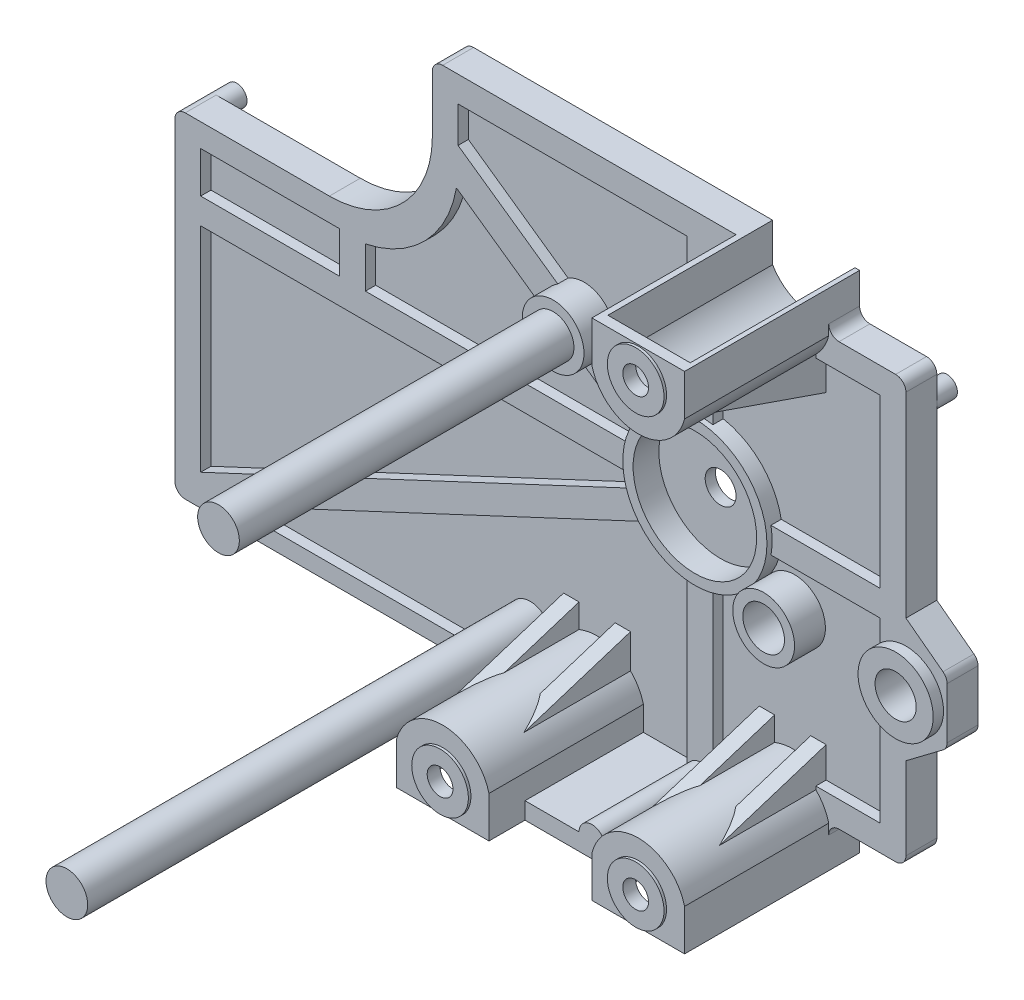
from build123d import *
from build123d.topology import SkipClean

# Parameters (mm, degrees)
SALIENTE_EXTRUIR1_DEPTH     = 3
SALIENTE_EXTRUIR2_DEPTH     = 28
SALIENTE_EXTRUIR3_DEPTH     = 21
CORTAR_EXTRUIR1_START       = -2
CROQUIS7_W                  = 27
CROQUIS7_H                  = 8
CORTAR_EXTRUIR1_DEPTH       = 2
CROQUIS8_R                  = 14
CROQUIS8_R_2                = 12
SALIENTE_EXTRUIR4_DEPTH     = 1
CORTAR_EXTRUIR2_DEPTH       = 39
CORTAR_EXTRUIR2_DEPTH_BACK  = 37
CROQUIS9_R                  = 3
CROQUIS10_R                 = 12
CROQUIS10_R_2               = 3
CORTAR_EXTRUIR3_DEPTH       = 4
SALIENTE_EXTRUIR7_DEPTH     = 1.5
SALIENTE_EXTRUIR8_DEPTH     = 1.5
SALIENTE_EXTRUIR9_DEPTH     = 1.5
SALIENTE_EXTRUIR10_DEPTH    = 1.5
SALIENTE_EXTRUIR11_DEPTH    = 1.5
SALIENTE_EXTRUIR12_DEPTH    = 1.5
CROQUIS22_R                 = 6
CROQUIS22_R_2               = 4.05
SALIENTE_EXTRUIR15_DEPTH    = 6
SALIENTE_EXTRUIR15_2_DEPTH  = 6
CORTAR_EXTRUIR6_DEPTH       = 22
CORTAR_EXTRUIR6_DEPTH_BACK  = 17
CROQUIS23_R                 = 4.05
CROQUIS24_R                 = 5.5
SALIENTE_EXTRUIR16_DEPTH    = 0.5
CROQUIS25_R                 = 2.5
CORTAR_EXTRUIR7_DEPTH       = 40.5
SALIENTE_EXTRUIR17_DEPTH    = 3.282447
CORTAR_EXTRUIR8_DEPTH       = 32
CORTAR_EXTRUIR9_DEPTH       = 32
CORTAR_EXTRUIR10_DEPTH      = 32
SALIENTE_EXTRUIR18_DEPTH    = 4
CROQUIS33_R                 = 0.75
CORTAR_EXTRUIR11_DEPTH      = 4
CROQUIS34_R                 = 2
SALIENTE_EXTRUIR19_DEPTH    = 4
CROQUIS35_R                 = 1
CORTAR_EXTRUIR12_DEPTH      = 3.5
CROQUIS36_R                 = 0.8
SALIENTE_EXTRUIR20_DEPTH    = 0.2
C_PULA1_FACE_RADIUS         = 0.8
C_PULA1_HEIGHT              = 1
CROQUIS39_R                 = 7.3
SALIENTE_EXTRUIR21_DEPTH    = 4
CORTAR_EXTRUIR13_DEPTH      = 26
CORTAR_EXTRUIR13_DEPTH_BACK = 38
CROQUIS40_R                 = 4
CROQUIS41_R                 = 4.05
SALIENTE_EXTRUIR23_DEPTH    = 90
CROQUIS42_R                 = 4.05
SALIENTE_EXTRUIR24_DEPTH    = 65


with BuildPart() as part:
    # Croquis3 → Saliente-Extruir1 (new, symmetric)
    with BuildSketch(Plane.XY):
        with BuildLine():
            Line((48.723300971, -56.222087379), (48.723300971, -50.222087379))
            ThreePointArc((48.723300971, -50.222087379), (49.309087409, -48.807873816), (50.723300971, -48.222087379))
            Line((50.723300971, -48.222087379), (61.723300971, -48.222087379))
            ThreePointArc((61.723300971, -48.222087379), (63.137514533, -47.636300941), (63.723300971, -46.222087379))
            Line((63.723300971, -46.222087379), (63.723300971, -30.222087379))
            Line((63.723300971, -30.222087379), (70.926931017, -24.793762782))
            ThreePointArc((70.926931017, -24.793762782), (71.513169694, -24.088887388), (71.723300971, -23.196491762))
            Line((71.723300971, -23.196491762), (71.723300971, -13.247682996))
            ThreePointArc((71.723300971, -13.247682996), (71.513169694, -12.355287369), (70.926931017, -11.650411975))
            Line((70.926931017, -11.650411975), (63.723300971, -6.222087379))
            Line((63.723300971, -6.222087379), (63.723300971, 31.777912621))
            ThreePointArc((63.723300971, 31.777912621), (63.137514533, 33.192126184), (61.723300971, 33.777912621))
            Line((61.723300971, 33.777912621), (50.723300971, 33.777912621))
            ThreePointArc((50.723300971, 33.777912621), (49.309087409, 34.363699059), (48.723300971, 35.777912621))
            Line((48.723300971, 35.777912621), (48.723300971, 41.777912621))
            Line((48.723300971, 41.777912621), (-26.276699029, 41.777912621))
            ThreePointArc((-26.276699029, 41.777912621), (-27.690912591, 41.192126184), (-28.276699029, 39.777912621))
            Line((-28.276699029, 39.777912621), (-28.276699029, 28.777912621))
            ThreePointArc((-28.276699029, 28.777912621), (-34.134563405, 14.635776998), (-48.276699029, 8.777912621))
            Line((-48.276699029, 8.777912621), (-76.276699029, 8.777912621))
            ThreePointArc((-76.276699029, 8.777912621), (-77.690912591, 8.192126184), (-78.276699029, 6.777912621))
            Line((-78.276699029, 6.777912621), (-78.276699029, -54.222087379))
            ThreePointArc((-78.276699029, -54.222087379), (-77.690912591, -55.636300941), (-76.276699029, -56.222087379))
            Line((-76.276699029, -56.222087379), (48.723300971, -56.222087379))
        make_face()
    extrude(amount=SALIENTE_EXTRUIR1_DEPTH, both=True)

    # Croquis4 → Saliente-Extruir2 (add)
    with BuildSketch(Plane.XY.offset(3)):
        with BuildLine():
            Line((30.723300971, 41.777912621), (30.723300971, 33.777912621))
            ThreePointArc((30.723300971, 33.777912621), (39.723300971, 26.76030074), (48.723300971, 33.777912621))
            Line((48.723300971, 33.777912621), (48.723300971, 41.777912621))
            Line((48.723300971, 41.777912621), (30.723300971, 41.777912621))
        make_face()
        with BuildLine():
            Line((48.723300971, -56.222087379), (48.723300971, -48.222087379))
            ThreePointArc((48.723300971, -48.222087379), (39.723300971, -41.204475497), (30.723300971, -48.222087379))
            Line((30.723300971, -48.222087379), (30.723300971, -56.222087379))
            Line((30.723300971, -56.222087379), (48.723300971, -56.222087379))
        make_face()
        with BuildLine():
            Line((10.723300971, -56.222087379), (10.723300971, -48.222087379))
            ThreePointArc((10.723300971, -48.222087379), (1.723300971, -41.204475497), (-7.276699029, -48.222087379))
            Line((-7.276699029, -48.222087379), (-7.276699029, -56.222087379))
            Line((-7.276699029, -56.222087379), (10.723300971, -56.222087379))
        make_face()
    extrude(amount=SALIENTE_EXTRUIR2_DEPTH)

    # Croquis5 → Saliente-Extruir3 (add)
    with BuildSketch(Plane.XY.offset(3)):
        with BuildLine():
            Line((10.723300971, -56.222087379), (10.723300971, -52.939642318))
            Line((10.723300971, -52.939642318), (21.223300971, -52.939642318))
            ThreePointArc((21.223300971, -52.939642318), (23.723300971, -50.439642318), (26.223300971, -52.939642318))
            Line((26.223300971, -52.939642318), (30.723300971, -52.939642318))
            Line((30.723300971, -52.939642318), (30.723300971, -56.222087379))
            Line((30.723300971, -56.222087379), (10.723300971, -56.222087379))
        make_face()
    extrude(amount=SALIENTE_EXTRUIR3_DEPTH)

    # Croquis7 → Cortar-Extruir1 (cut)
    with BuildSketch(Plane.XY.offset(3).offset(CORTAR_EXTRUIR1_START)):
        with BuildLine():
            Line((-73.276699029, -8.722087379), (-73.276699029, -50.179501513))
            Line((-73.276699029, -50.179501513), (10.54826866, -10.956907714))
            ThreePointArc((10.54826866, -10.956907714), (10.202045105, -9.851913796), (9.948323657, -8.722087379))
            Line((9.948323657, -8.722087379), (-73.276699029, -8.722087379))
        make_face()
        with Locations((-59.776699029, 0.277912621)):
            Rectangle(CROQUIS7_W, CROQUIS7_H)
        with BuildLine():
            Line((-23.276699029, 36.777912621), (16.723300971, 36.777912621))
            Line((16.723300971, 36.777912621), (21.223300971, 36.777912621))
            Line((21.223300971, 36.777912621), (21.223300971, 7.552889935))
            ThreePointArc((21.223300971, 7.552889935), (17.239971214, 6.186233832), (13.843272479, 3.696835799))
            Line((13.843272479, 3.696835799), (-23.276699029, 29.796763611))
            Line((-23.276699029, 29.796763611), (-23.276699029, 36.777912621))
        make_face()
        with BuildLine():
            Line((-41.276699029, 4.232504936), (-41.276699029, -3.722087379))
            Line((-41.276699029, -3.722087379), (4.723442905, -3.722087379))
            Line((4.723442905, -3.722087379), (9.948323657, -3.722087379))
            ThreePointArc((9.948323657, -3.722087379), (10.200034776, -2.599757822), (10.543026708, -1.50187866))
            Line((10.543026708, -1.50187866), (-23.595805676, 22.501939894))
            ThreePointArc((-23.595805676, 22.501939894), (-29.60850244, 10.63056719), (-41.276699029, 4.232504936))
        make_face()
        with BuildLine():
            Line((26.223300971, 36.777912621), (26.223300971, 7.552889935))
            ThreePointArc((26.223300971, 7.552889935), (33.622795907, 3.677407558), (37.498278285, -3.722087379))
            Line((37.498278285, -3.722087379), (58.723300971, -3.722087379))
            Line((58.723300971, -3.722087379), (58.723300971, 28.777912621))
            Line((58.723300971, 28.777912621), (45.500507806, 28.777912621))
            ThreePointArc((45.500507806, 28.777912621), (36.748977696, 27.249862693), (30.723300971, 33.777912621))
            Line((30.723300971, 33.777912621), (30.723300971, 36.777912621))
            Line((30.723300971, 36.777912621), (26.223300971, 36.777912621))
        make_face()
        with BuildLine():
            Line((37.498278285, -8.722087379), (58.723300971, -8.722087379))
            Line((58.723300971, -8.722087379), (58.723300971, -43.222087379))
            Line((58.723300971, -43.222087379), (45.500507806, -43.222087379))
            ThreePointArc((45.500507806, -43.222087379), (36.748977696, -41.694037451), (30.723300971, -48.222087379))
            Line((30.723300971, -48.222087379), (30.723300971, -52.939642318))
            Line((30.723300971, -52.939642318), (26.223300971, -52.939642318))
            Line((26.223300971, -52.939642318), (26.223300971, -43.525335216))
            Line((26.223300971, -43.525335216), (26.223300971, -19.997064693))
            ThreePointArc((26.223300971, -19.997064693), (33.622795907, -16.121582315), (37.498278285, -8.722087379))
        make_face()
        with BuildLine():
            Line((21.223300971, -52.939642318), (21.223300971, -19.997064693))
            ThreePointArc((21.223300971, -19.997064693), (16.737476548, -18.354616263), (13.065010864, -15.299578882))
            Line((13.065010864, -15.299578882), (-67.377835865, -52.939642318))
            Line((-67.377835865, -52.939642318), (-7.276699029, -52.939642318))
            Line((-7.276699029, -52.939642318), (-7.276699029, -48.222087379))
            ThreePointArc((-7.276699029, -48.222087379), (1.723300971, -41.204475497), (10.723300971, -48.222087379))
            Line((10.723300971, -48.222087379), (10.723300971, -52.939642318))
            Line((10.723300971, -52.939642318), (21.223300971, -52.939642318))
        make_face()
    extrude(amount=CORTAR_EXTRUIR1_DEPTH, mode=Mode.SUBTRACT)

    # Croquis8 → Saliente-Extruir4 (add)
    with SkipClean():  # the faces are left unmerged after this step: merging them gives an invalid solid
        with BuildSketch(Plane.XY.offset(3)):
            with Locations((23.723300971, -6.222087379)):
                Circle(CROQUIS8_R)
            with Locations((23.723300971, -6.222087379)):
                Circle(CROQUIS8_R_2, mode=Mode.SUBTRACT)
        extrude(amount=SALIENTE_EXTRUIR4_DEPTH)

    # Croquis9 → Cortar-Extruir2 (cut, two sides: drawn at the far end of the back side and taken through both)
    with SkipClean():  # the faces are left unmerged after this step: merging them gives an invalid solid
        with BuildSketch(Plane.XY.offset(3).offset(-CORTAR_EXTRUIR2_DEPTH_BACK)):
            with Locations((23.723300971, -6.222087379)):
                Circle(CROQUIS9_R)
        extrude(amount=CORTAR_EXTRUIR2_DEPTH + CORTAR_EXTRUIR2_DEPTH_BACK, mode=Mode.SUBTRACT)

    # Croquis10 → Cortar-Extruir3 (cut)
    with SkipClean():  # the faces are left unmerged after this step: merging them gives an invalid solid
        with BuildSketch(Plane.XY.offset(3)):
            with Locations((23.723300971, -6.222087379)):
                Circle(CROQUIS10_R)
            with Locations((23.723300971, -6.222087379)):
                Circle(CROQUIS10_R_2, mode=Mode.SUBTRACT)
        extrude(amount=-CORTAR_EXTRUIR3_DEPTH, mode=Mode.SUBTRACT)

    # Croquis15 → Saliente-Extruir7 (add, symmetric)
    with SkipClean():  # the faces are left unmerged after this step: merging them gives an invalid solid
        with BuildSketch(Plane.ZY.offset(3.276699029)):
            Polygon((25.08, -44.936835027), (3, -44.936835027), (0, -44.936835027), (0, -36.936835027), align=None)
        extrude(amount=SALIENTE_EXTRUIR7_DEPTH, both=True)

    # Croquis17 → Saliente-Extruir8 (add, symmetric)
    with SkipClean():  # the faces are left unmerged after this step: merging them gives an invalid solid
        with BuildSketch(Plane(origin=(6.723300971, 0, 0), x_dir=(0, 0, -1), z_dir=(1, 0, 0))):
            Polygon((-1, -43.861153068), (-1, -37.255814293), (-21.707737059, -43.861153068), align=None)
        extrude(amount=SALIENTE_EXTRUIR8_DEPTH, both=True)

    # Croquis18 → Saliente-Extruir9 (add, symmetric)
    with SkipClean():  # the faces are left unmerged after this step: merging them gives an invalid solid
        with BuildSketch(Plane.ZY.offset(-34.723300971)):
            Polygon((1, -37.255814293), (1, -43.861153068), (21.707737059, -43.861153068), align=None)
        extrude(amount=SALIENTE_EXTRUIR9_DEPTH, both=True)

    # Croquis19 → Saliente-Extruir10 (add, symmetric)
    with SkipClean():  # the faces are left unmerged after this step: merging them gives an invalid solid
        with BuildSketch(Plane(origin=(44.723300971, 0, 0), x_dir=(0, 0, -1), z_dir=(1, 0, 0))):
            Polygon((-1, -43.861153068), (-1, -37.255814293), (-21.707737059, -43.861153068), align=None)
        extrude(amount=SALIENTE_EXTRUIR10_DEPTH, both=True)

    # Croquis20 → Saliente-Extruir11 (add, symmetric)
    with SkipClean():  # the faces are left unmerged after this step: merging them gives an invalid solid
        with BuildSketch(Plane.ZY.offset(-34.723300971)):
            Polygon((0, 29.834262637), (0, 21.627777916), (23.680931843, 29.834262637), align=None)
        extrude(amount=SALIENTE_EXTRUIR11_DEPTH, both=True)

    # Croquis21 → Saliente-Extruir12 (add, symmetric)
    with SkipClean():  # the faces are left unmerged after this step: merging them gives an invalid solid
        with BuildSketch(Plane(origin=(44.723300971, 0, 0), x_dir=(0, 0, -1), z_dir=(1, 0, 0))):
            Polygon((-1, 29.416978311), (-22.476800962, 29.416978311), (-1, 21.974321911), align=None)
        extrude(amount=SALIENTE_EXTRUIR12_DEPTH, both=True)

    # Croquis23 → Cortar-Extruir6 (cut, two sides: drawn at the far end of the back side and taken through both)
    with BuildSketch(Plane.XY.offset(1).offset(-CORTAR_EXTRUIR6_DEPTH_BACK)):
        with Locations((-0.817590004, 11.033192108)):
            Circle(CROQUIS23_R)
        with Locations((40.083894954, -17.725607036)):
            Circle(CROQUIS23_R)
    extrude(amount=CORTAR_EXTRUIR6_DEPTH + CORTAR_EXTRUIR6_DEPTH_BACK, mode=Mode.SUBTRACT)

    # Croquis24 → Saliente-Extruir16 (add)
    with BuildSketch(Plane.XY.offset(31)):
        with Locations(Location((1.723300971, -50.484475497, 0), (0, 0, 180))):
            Circle(CROQUIS24_R)
        with Locations(Location((39.723300971, -50.484475497, 0), (0, 0, 180))):
            Circle(CROQUIS24_R)
        with Locations((39.723300971, 36.04030074)):
            Circle(CROQUIS24_R)
    extrude(amount=SALIENTE_EXTRUIR16_DEPTH)

    # Croquis25 → Cortar-Extruir7 (cut)
    with BuildSketch(Plane.XY.offset(31.5)):
        with Locations((1.723300971, -50.484475497)):
            Circle(CROQUIS25_R)
        with Locations((39.723300971, -50.484475497)):
            Circle(CROQUIS25_R)
        with Locations((39.723300971, 36.04030074)):
            Circle(CROQUIS25_R)
    extrude(amount=-CORTAR_EXTRUIR7_DEPTH, mode=Mode.SUBTRACT)

    # Croquis27 → Saliente-Extruir17 (add)
    with BuildSketch(Plane(origin=(0, -56.222087379, 0), x_dir=(-1, 0, 0), z_dir=(0, -1, 0))):
        Polygon((7.276699029, -3), (15.276699029, -3), (7.276699029, -13), align=None)
    extrude(amount=-SALIENTE_EXTRUIR17_DEPTH)

    # Croquis29 → Cortar-Extruir8 (cut)
    with BuildSketch(Plane(origin=(0, 0, -3), x_dir=(-1, 0, 0), z_dir=(0, 0, -1))):
        with BuildLine():
            Line((-47.857764137, -56.222087379), (-47.857764137, -48.722087379))
            ThreePointArc((-47.857764137, -48.722087379), (-39.857764137, -44.154809052), (-31.857764137, -48.722087379))
            Line((-31.857764137, -48.722087379), (-31.857764137, -56.222087379))
            Line((-31.857764137, -56.222087379), (-47.857764137, -56.222087379))
        make_face()
    extrude(amount=-CORTAR_EXTRUIR8_DEPTH, mode=Mode.SUBTRACT)

    # Croquis30 → Cortar-Extruir9 (cut)
    with BuildSketch(Plane(origin=(0, 0, -3), x_dir=(-1, 0, 0), z_dir=(0, 0, -1))):
        with BuildLine():
            Line((-9.853300971, -56.222087379), (-9.853300971, -48.722087379))
            ThreePointArc((-9.853300971, -48.722087379), (-1.853300971, -44.154809052), (6.146699029, -48.722087379))
            Line((6.146699029, -48.722087379), (6.146699029, -56.222087379))
            Line((6.146699029, -56.222087379), (-9.853300971, -56.222087379))
        make_face()
    extrude(amount=-CORTAR_EXTRUIR9_DEPTH, mode=Mode.SUBTRACT)

    # Croquis31 → Cortar-Extruir10 (cut)
    with BuildSketch(Plane(origin=(0, 0, -3), x_dir=(-1, 0, 0), z_dir=(0, 0, -1))):
        with BuildLine():
            Line((-47.823300971, 41.777912621), (-47.823300971, 34.277912621))
            ThreePointArc((-47.823300971, 34.277912621), (-39.823300971, 29.710634294), (-31.823300971, 34.277912621))
            Line((-31.823300971, 34.277912621), (-31.823300971, 41.777912621))
            Line((-31.823300971, 41.777912621), (-47.823300971, 41.777912621))
        make_face()
    extrude(amount=-CORTAR_EXTRUIR10_DEPTH, mode=Mode.SUBTRACT)

    # Croquis32 → Saliente-Extruir18 (add)
    with BuildSketch(Plane(origin=(0, 0, -3), x_dir=(-1, 0, 0), z_dir=(0, 0, -1))):
        with BuildLine():
            Line((9.146699029, -56.222087379), (9.146699029, -51.222087379))
            ThreePointArc((9.146699029, -51.222087379), (9.439592248, -50.514980597), (10.146699029, -50.222087379))
            Line((10.146699029, -50.222087379), (13.646699029, -50.222087379))
            ThreePointArc((13.646699029, -50.222087379), (14.707359201, -49.78274755), (15.146699029, -48.722087379))
            Line((15.146699029, -48.722087379), (15.146699029, -47.222087379))
            ThreePointArc((15.146699029, -47.222087379), (15.439592248, -46.514980597), (16.146699029, -46.222087379))
            Line((16.146699029, -46.222087379), (32.146699029, -46.222087379))
            ThreePointArc((32.146699029, -46.222087379), (32.85380581, -46.514980597), (33.146699029, -47.222087379))
            Line((33.146699029, -47.222087379), (33.146699029, -48.722087379))
            ThreePointArc((33.146699029, -48.722087379), (33.586038857, -49.78274755), (34.646699029, -50.222087379))
            Line((34.646699029, -50.222087379), (38.146699029, -50.222087379))
            ThreePointArc((38.146699029, -50.222087379), (38.85380581, -50.514980597), (39.146699029, -51.222087379))
            Line((39.146699029, -51.222087379), (39.146699029, -56.222087379))
            Line((39.146699029, -56.222087379), (9.146699029, -56.222087379))
        make_face()
    extrude(amount=SALIENTE_EXTRUIR18_DEPTH)

    # Croquis33 → Cortar-Extruir11 (cut)
    with BuildSketch(Plane(origin=(0, 0, -7), x_dir=(-1, 0, 0), z_dir=(0, 0, -1))):
        with Locations((11.146699029, -53.722087379)):
            Circle(CROQUIS33_R)
        with Locations((37.146699029, -53.722087379)):
            Circle(CROQUIS33_R)
    extrude(amount=-CORTAR_EXTRUIR11_DEPTH, mode=Mode.SUBTRACT)

    # Croquis34 → Saliente-Extruir19 (add)
    with SkipClean():  # the faces are left unmerged after this step: merging them gives an invalid solid
        with BuildSketch(Plane(origin=(0, 0, -3), x_dir=(-1, 0, 0), z_dir=(0, 0, -1))):
            with Locations((76.276699029, 6.777912621)):
                Circle(CROQUIS34_R)
            with Locations(Location((-61.723300971, 26.777912621, 0), (0, 0, 180))):
                Circle(CROQUIS34_R)
            with Locations(Location((-61.723300971, -26.222087379, 0), (0, 0, 180))):
                Circle(CROQUIS34_R)
            with BuildLine():
                Line((74.276699029, -54.222087379), (74.276699029, -50.222087379))
                ThreePointArc((74.276699029, -50.222087379), (76.276699029, -48.222087379), (78.276699029, -50.222087379))
                Line((78.276699029, -50.222087379), (78.276699029, -54.222087379))
                ThreePointArc((78.276699029, -54.222087379), (76.276699029, -56.222087379), (74.276699029, -54.222087379))
            make_face()
        extrude(amount=SALIENTE_EXTRUIR19_DEPTH)

    # Croquis35 → Cortar-Extruir12 (cut)
    with SkipClean():  # the faces are left unmerged after this step: merging them gives an invalid solid
        with BuildSketch(Plane(origin=(0, 0, -7), x_dir=(-1, 0, 0), z_dir=(0, 0, -1))):
            with Locations((-61.723300971, 26.777912621)):
                Circle(CROQUIS35_R)
            with Locations((-61.723300971, -26.222087379)):
                Circle(CROQUIS35_R)
            with Locations((76.276699029, 6.777912621)):
                Circle(CROQUIS35_R)
            with Locations((76.276699029, -54.222087379)):
                Circle(CROQUIS35_R)
        extrude(amount=-CORTAR_EXTRUIR12_DEPTH, mode=Mode.SUBTRACT)

    # Croquis36 → Saliente-Extruir20 (add)
    with SkipClean():  # the faces are left unmerged after this step: merging them gives an invalid solid
        with BuildSketch(Plane(origin=(0, 0, -7), x_dir=(-1, 0, 0), z_dir=(0, 0, -1))):
            with Locations((76.276699029, -50.222087379)):
                Circle(CROQUIS36_R)
        extrude(amount=SALIENTE_EXTRUIR20_DEPTH)

    # Cúpula1: a dome of height H over a round flat face of radius A is a cap of a sphere of radius (A * A + H * H) / (2 * H)
    c_pula1_r = (C_PULA1_FACE_RADIUS * C_PULA1_FACE_RADIUS + C_PULA1_HEIGHT * C_PULA1_HEIGHT) / (2 * C_PULA1_HEIGHT)
    c_pula1_base = Plane((-76.276699029, -50.222087379, -7.2), z_dir=(0, 0, -1))
    with Locations(c_pula1_base.offset(C_PULA1_HEIGHT - c_pula1_r)):
        c_pula1_ball = Sphere(c_pula1_r, mode=Mode.PRIVATE)
    add(split(c_pula1_ball, bisect_by=c_pula1_base, keep=Keep.TOP, mode=Mode.PRIVATE))

    # Croquis39 → Saliente-Extruir21 (add)
    with SkipClean():  # the faces are left unmerged after this step: merging them gives an invalid solid
        with BuildSketch(Plane.XY.offset(1)):
            with Locations(Location((63.723300971, -18.222087379, 0), (0, 0, 226.769779211))):
                Circle(CROQUIS39_R)
        extrude(amount=SALIENTE_EXTRUIR21_DEPTH)

    # Croquis40 → Cortar-Extruir13 (cut, two sides: drawn at the far end of the back side and taken through both)
    with SkipClean():  # the faces are left unmerged after this step: merging them gives an invalid solid
        with BuildSketch(Plane.XY.offset(5).offset(-CORTAR_EXTRUIR13_DEPTH_BACK)):
            with Locations((63.723300971, -18.222087379)):
                Circle(CROQUIS40_R)
        extrude(amount=CORTAR_EXTRUIR13_DEPTH + CORTAR_EXTRUIR13_DEPTH_BACK, mode=Mode.SUBTRACT)


with BuildPart() as body_2:
    # Croquis22 → Saliente-Extruir15 (new body)
    with BuildSketch(Plane.XY.offset(1)):
        with Locations((40.083894954, -17.725607036)):
            Circle(CROQUIS22_R)
        with Locations((40.083894954, -17.725607036)):
            Circle(CROQUIS22_R_2, mode=Mode.SUBTRACT)
    extrude(amount=SALIENTE_EXTRUIR15_DEPTH)


with BuildPart() as body_3:
    # Croquis22 → Saliente-Extruir15 2 (new body)
    with BuildSketch(Plane.XY.offset(1)):
        with Locations((-0.817590004, 11.033192108)):
            Circle(CROQUIS22_R)
        with Locations((-0.817590004, 11.033192108)):
            Circle(CROQUIS22_R_2, mode=Mode.SUBTRACT)
    extrude(amount=SALIENTE_EXTRUIR15_2_DEPTH)


    with SkipClean():  # the faces are left unmerged after this step: merging them gives an invalid solid
        add(part.part)  # Saliente-Extruir24 merges part
        # Croquis42 → Saliente-Extruir24 (add)
        with BuildSketch(Plane.XY.offset(7)):
            with Locations((-0.817590004, 11.033192108)):
                Circle(CROQUIS42_R)
        extrude(amount=SALIENTE_EXTRUIR24_DEPTH)


with BuildPart() as body_4:
    # Croquis41 → Saliente-Extruir23 (new body)
    with BuildSketch(Plane.XY.offset(1)):
        with Locations(Location((-11.276699029, -45.939642318, 0), (0, 0, 180))):
            Circle(CROQUIS41_R)
    extrude(amount=SALIENTE_EXTRUIR23_DEPTH)


solid = Compound([body_2.part, body_3.part, body_4.part])
